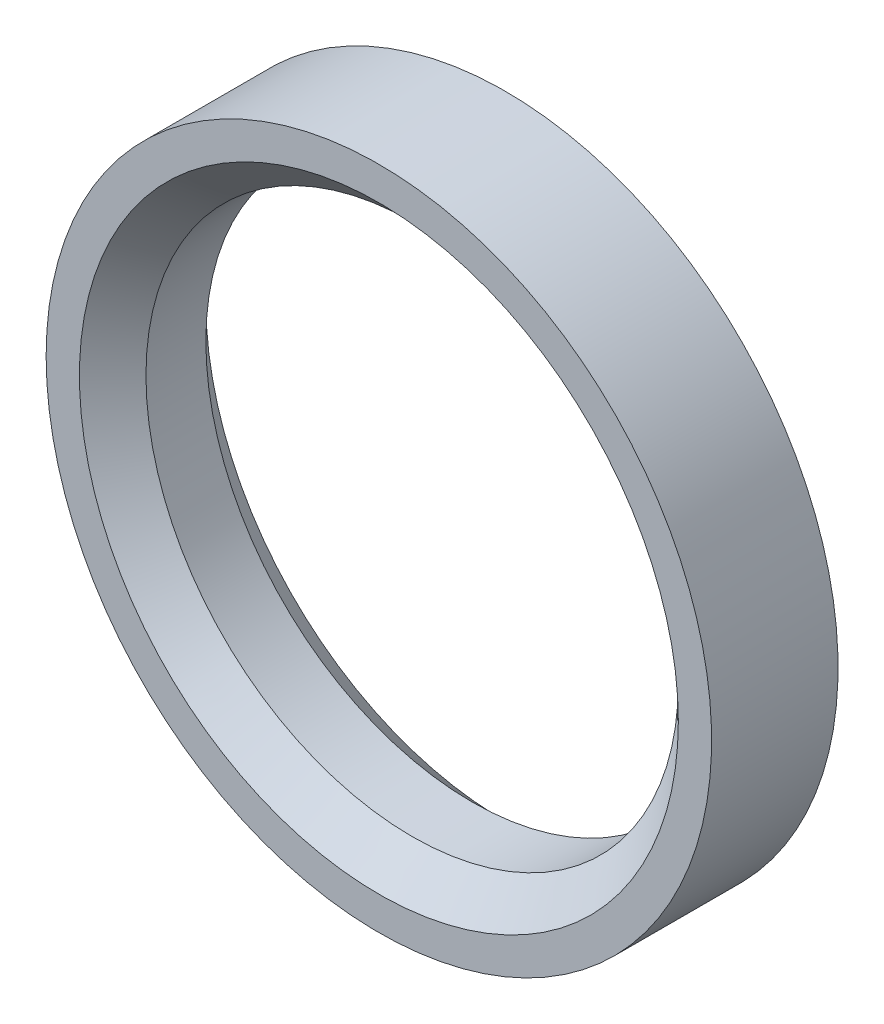
from build123d import *

# Parameters (mm, degrees)
SKETCH_1_R      = 5
SKETCH_1_R_2    = 4
EXTRUDE_1_DEPTH = 1.9
CHAMFER_1_SIZE  = 0.5


with BuildPart() as part:
    # 草圖1 → 伸長1 (new body)
    with BuildSketch(Plane.XY):
        with Locations(Location((0, 0, 0), (0, 0, 180))):
            Circle(SKETCH_1_R)
        with Locations(Location((0, 0, 0), (0, 0, 180))):
            Circle(SKETCH_1_R_2, mode=Mode.SUBTRACT)
    extrude(amount=EXTRUDE_1_DEPTH)

    # 導角1
    chamfer_1_edges = [part.edges().sort_by_distance(p)[0] for p in [
        (4, 0, 0),
        (4, 0, 1.9),
    ]]
    chamfer(chamfer_1_edges, length=CHAMFER_1_SIZE)


solid = part.part
